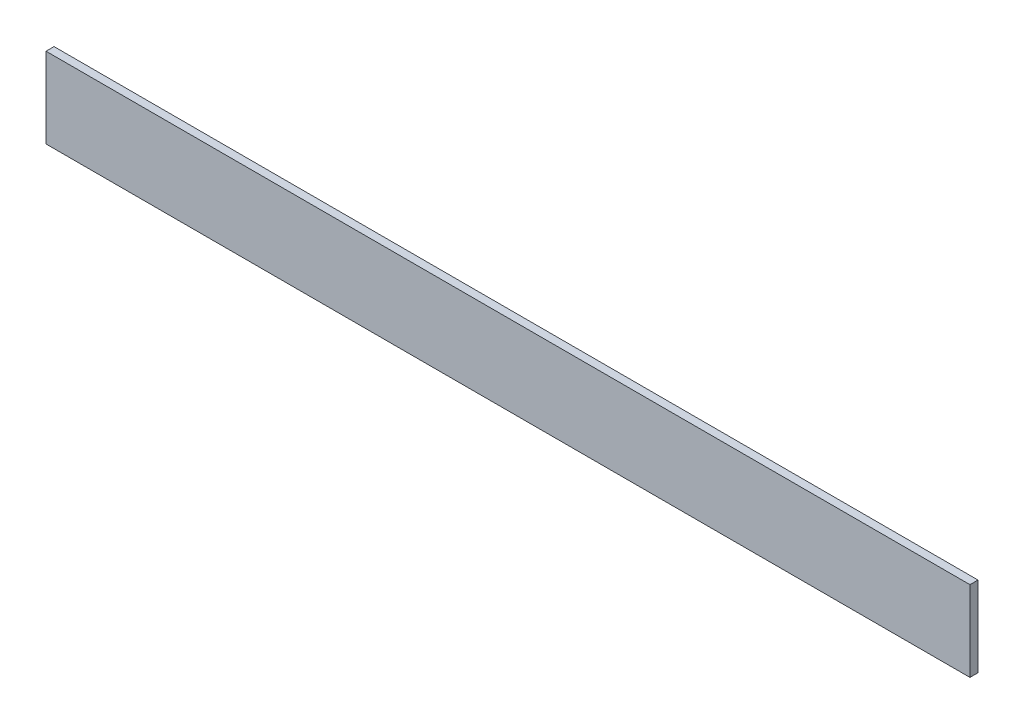
from build123d import *

# Parameters (mm, degrees)
SKETCH1_W           = 584.2
SKETCH1_H           = 5.08
BOSS_EXTRUDE2_DEPTH = 50.8


with BuildPart() as part:
    # Sketch1 → Boss-Extrude2 (new body)
    with BuildSketch(Plane(origin=(0, 0, 0), x_dir=(1, 0, 0), z_dir=(0, 1, 0))):
        with Locations((292.1, 2.54)):
            Rectangle(SKETCH1_W, SKETCH1_H)
    extrude(amount=BOSS_EXTRUDE2_DEPTH)


solid = part.part
